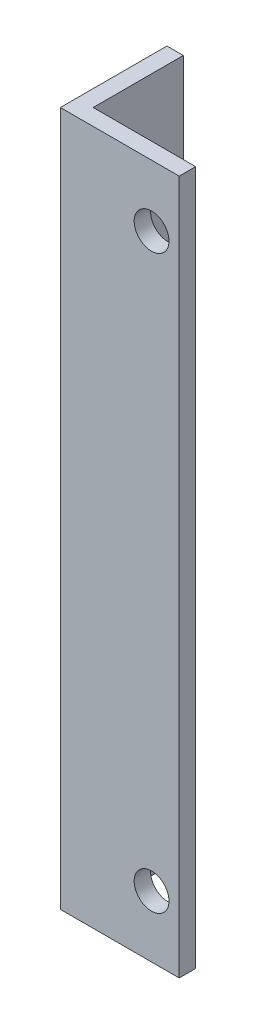
from build123d import *

# Parameters (mm, degrees)
CROQUIS1_W              = 25
CROQUIS1_H              = 3
SALIENTE_EXTRUIR1_DEPTH = 195
CROQUIS2_R              = 4.25
CORTAR_EXTRUIR1_DEPTH   = 195
CROQUIS3_W              = 4
CROQUIS3_H              = 25
SALIENTE_EXTRUIR2_DEPTH = 195
SALIENTE_EXTRUIR3_START = 1
CROQUIS4_W              = 29
CROQUIS4_H              = 195
CROQUIS4_R              = 4.25
SALIENTE_EXTRUIR3_DEPTH = 1
CROQUIS5_W              = 80.668780501
CROQUIS5_H              = 25.5
CORTAR_EXTRUIR2_DEPTH   = 30
CROQUIS6_R              = 4.25
CORTAR_EXTRUIR3_DEPTH   = 30
CROQUIS7_R              = 4.25
SALIENTE_EXTRUIR4_DEPTH = 4


with BuildPart() as part:
    # Croquis1 → Saliente-Extruir1 (new body)
    with BuildSketch(Plane(origin=(0, 0, 0), x_dir=(1, 0, 0), z_dir=(0, 1, 0))):
        with Locations((12.5, -1.5)):
            Rectangle(CROQUIS1_W, CROQUIS1_H)
    extrude(amount=SALIENTE_EXTRUIR1_DEPTH)

    # Croquis2 → Cortar-Extruir1 (cut)
    with BuildSketch(Plane.XY.offset(3)):
        with Locations((18.25, 180)):
            Circle(CROQUIS2_R)
        with Locations((18.25, 97.5)):
            Circle(CROQUIS2_R)
        with Locations((18.25, 15)):
            Circle(CROQUIS2_R)
    extrude(amount=-CORTAR_EXTRUIR1_DEPTH, mode=Mode.SUBTRACT)

    # Croquis3 → Saliente-Extruir2 (add)
    with BuildSketch(Plane(origin=(0, 195, 0), x_dir=(1, 0, 0), z_dir=(0, 1, 0))):
        with Locations((-2, 9.5)):
            Rectangle(CROQUIS3_W, CROQUIS3_H)
    extrude(amount=-SALIENTE_EXTRUIR2_DEPTH)

    # Croquis4 → Saliente-Extruir3 (add)
    with BuildSketch(Plane.XY.offset(3).offset(SALIENTE_EXTRUIR3_START)):
        with Locations((10.5, 97.5)):
            Rectangle(CROQUIS4_W, CROQUIS4_H)
        with Locations((18.25, 15)):
            Circle(CROQUIS4_R, mode=Mode.SUBTRACT)
        with Locations((18.25, 97.5)):
            Circle(CROQUIS4_R, mode=Mode.SUBTRACT)
        with Locations((18.25, 180)):
            Circle(CROQUIS4_R, mode=Mode.SUBTRACT)
    extrude(amount=-SALIENTE_EXTRUIR3_DEPTH)

    # Croquis5 → Cortar-Extruir2 (cut)
    with BuildSketch(Plane.XY.offset(4)):
        with Locations((-15.334390251, 182.25)):
            Rectangle(CROQUIS5_W, CROQUIS5_H)
    extrude(amount=-CORTAR_EXTRUIR2_DEPTH, mode=Mode.SUBTRACT)

    # Croquis6 → Cortar-Extruir3 (cut)
    with BuildSketch(Plane.XY.offset(4)):
        with Locations((18.25, 154.5)):
            Circle(CROQUIS6_R)
    extrude(amount=-CORTAR_EXTRUIR3_DEPTH, mode=Mode.SUBTRACT)

    # Croquis7 → Saliente-Extruir4 (add)
    with BuildSketch(Plane.XY.offset(4)):
        with Locations((18.25, 97.5)):
            Circle(CROQUIS7_R)
    extrude(amount=-SALIENTE_EXTRUIR4_DEPTH)


solid = part.part
